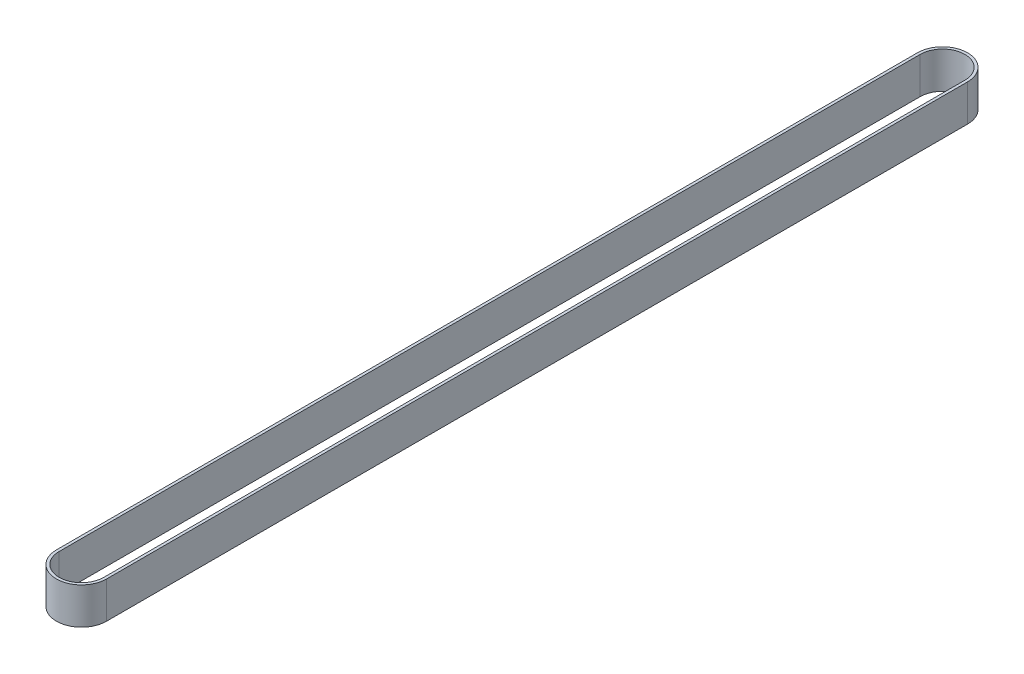
from build123d import *

# Parameters (mm, degrees)
EXTRUDE_1_DEPTH = 10


with BuildPart() as part:
    # 草图1 → 凸台-拉伸1 (new body)
    with BuildSketch(Plane(origin=(0, 0, 0), x_dir=(1, 0, 0), z_dir=(0, 1, 0))):
        with BuildLine():
            Line((-6.86, -117.55), (-6.86, 117.55))
            ThreePointArc((-6.86, 117.55), (0, 124.41), (6.86, 117.55))
            Line((6.86, 117.55), (6.86, -117.55))
            ThreePointArc((6.86, -117.55), (0, -124.41), (-6.86, -117.55))
        make_face()
        with BuildLine():
            Line((-6.11, -117.55), (-6.11, 117.55))
            ThreePointArc((-6.11, 117.55), (0, 123.66), (6.11, 117.55))
            Line((6.11, 117.55), (6.11, -117.55))
            ThreePointArc((6.11, -117.55), (0, -123.66), (-6.11, -117.55))
        make_face(mode=Mode.SUBTRACT)
    extrude(amount=EXTRUDE_1_DEPTH)


solid = part.part
